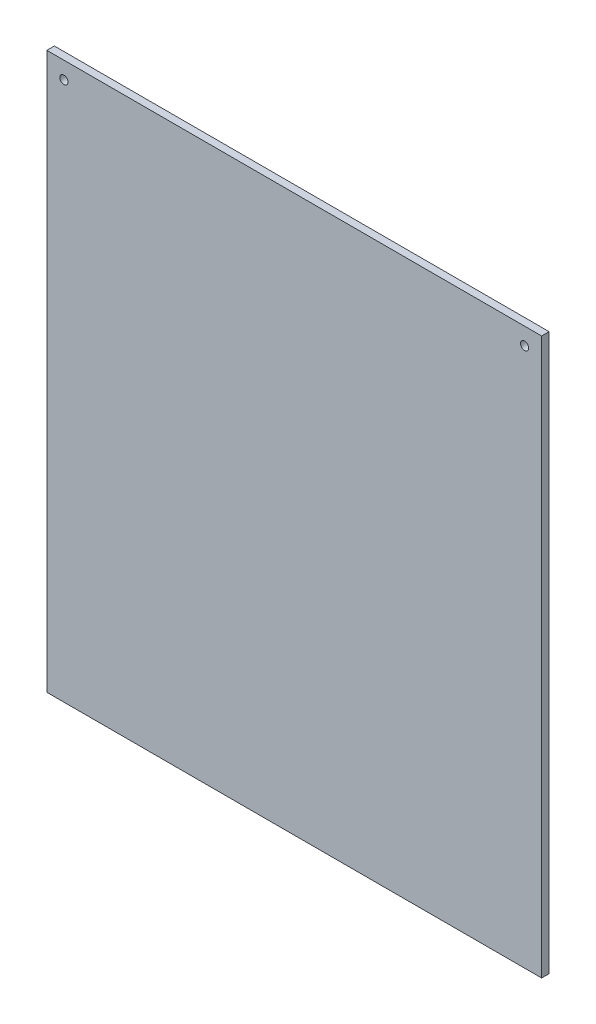
from build123d import *

# Parameters (mm, degrees)
SKETCH1_W           = 218
SKETCH1_H           = 245
SKETCH1_R           = 1.8
BOSS_EXTRUDE1_DEPTH = 3.302


with BuildPart() as part:
    # Sketch1 → Boss-Extrude1 (new body)
    with BuildSketch(Plane.XY):
        with Locations((-27.115183246, 2.382198953)):
            Rectangle(SKETCH1_W, SKETCH1_H)
        with Locations(Location((-128.615183246, 117.382198953, 0), (0, 0, 180))):
            Circle(SKETCH1_R, mode=Mode.SUBTRACT)
        with Locations(Location((74.384816754, 117.382198953, 0), (0, 0, 180))):
            Circle(SKETCH1_R, mode=Mode.SUBTRACT)
    extrude(amount=BOSS_EXTRUDE1_DEPTH)


solid = part.part
